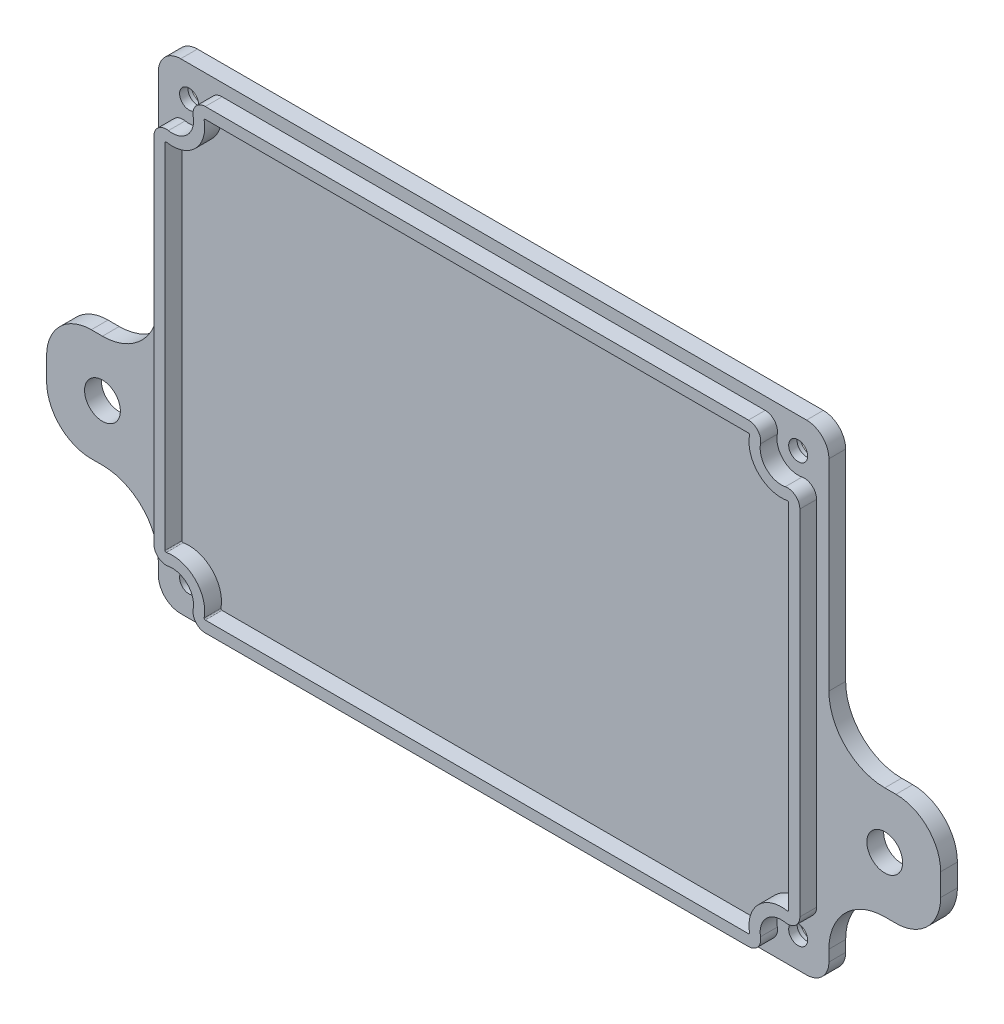
from build123d import *

# Parameters (mm, degrees)
SKETCH1_R           = 1.7
BOSS_EXTRUDE1_DEPTH = 3
BOSS_EXTRUDE2_DEPTH = 3
SKETCH3_R           = 3.2
BOSS_EXTRUDE3_DEPTH = 3
SKETCH4_R           = 2.85
SKETCH4_R_2         = 1.7
CUT_EXTRUDE1_DEPTH  = 1.5


with BuildPart() as part:
    # Sketch1 → Boss-Extrude1 (new body)
    with BuildSketch(Plane.XY):
        with BuildLine():
            Line((-56, -43), (56, -43))
            ThreePointArc((56, -43), (58.828427125, -41.828427125), (60, -39))
            Line((60, -39), (60, 39))
            ThreePointArc((60, 39), (58.828427125, 41.828427125), (56, 43))
            Line((56, 43), (-56, 43))
            ThreePointArc((-56, 43), (-58.828427125, 41.828427125), (-60, 39))
            Line((-60, 39), (-60, -39))
            ThreePointArc((-60, -39), (-58.828427125, -41.828427125), (-56, -43))
        make_face()
        with Locations((-54.5, 37.5)):
            Circle(SKETCH1_R, mode=Mode.SUBTRACT)
        with Locations(Location((-54.5, -37.5, 0), (0, 0, 180))):
            Circle(SKETCH1_R, mode=Mode.SUBTRACT)
        with Locations((54.5, -37.5)):
            Circle(SKETCH1_R, mode=Mode.SUBTRACT)
        with Locations(Location((54.5, 37.5, 0), (0, 0, 180))):
            Circle(SKETCH1_R, mode=Mode.SUBTRACT)
    extrude(amount=BOSS_EXTRUDE1_DEPTH)

    # Sketch2 → Boss-Extrude2 (add)
    with BuildSketch(Plane.XY.offset(3)):
        with BuildLine():
            Line((-57.8, 31.601695159), (-57.8, -31.601695159))
            ThreePointArc((-57.8, -31.601695159), (-57.005821231, -33.293932337), (-55.196666667, -33.764406934))
            ThreePointArc((-55.196666667, -33.764406934), (-51.812994231, -34.812994231), (-50.764406934, -38.196666667))
            ThreePointArc((-50.764406934, -38.196666667), (-50.293932337, -40.005821231), (-48.601695159, -40.8))
            Line((-48.601695159, -40.8), (48.601695159, -40.8))
            ThreePointArc((48.601695159, -40.8), (50.293932337, -40.005821231), (50.764406934, -38.196666667))
            ThreePointArc((50.764406934, -38.196666667), (51.812994231, -34.812994231), (55.196666667, -33.764406934))
            ThreePointArc((55.196666667, -33.764406934), (57.005821231, -33.293932337), (57.8, -31.601695159))
            Line((57.8, -31.601695159), (57.8, 31.601695159))
            ThreePointArc((57.8, 31.601695159), (57.005821231, 33.293932337), (55.196666667, 33.764406934))
            ThreePointArc((55.196666667, 33.764406934), (51.812994231, 34.812994231), (50.764406934, 38.196666667))
            ThreePointArc((50.764406934, 38.196666667), (50.293932337, 40.005821231), (48.601695159, 40.8))
            Line((48.601695159, 40.8), (-48.601695159, 40.8))
            ThreePointArc((-48.601695159, 40.8), (-50.293932337, 40.005821231), (-50.764406934, 38.196666667))
            ThreePointArc((-50.764406934, 38.196666667), (-51.812994231, 34.812994231), (-55.196666667, 33.764406934))
            ThreePointArc((-55.196666667, 33.764406934), (-57.005821231, 33.293932337), (-57.8, 31.601695159))
        make_face()
        with BuildLine():
            Line((-48.601695159, 38.8), (48.601695159, 38.8))
            ThreePointArc((48.601695159, 38.8), (48.755534902, 38.72780193), (48.79830532, 38.563333333))
            ThreePointArc((48.79830532, 38.563333333), (50.398780669, 33.398780669), (55.563333333, 31.79830532))
            ThreePointArc((55.563333333, 31.79830532), (55.72780193, 31.755534902), (55.8, 31.601695159))
            Line((55.8, 31.601695159), (55.8, -31.601695159))
            ThreePointArc((55.8, -31.601695159), (55.72780193, -31.755534902), (55.563333333, -31.79830532))
            ThreePointArc((55.563333333, -31.79830532), (50.398780669, -33.398780669), (48.79830532, -38.563333333))
            ThreePointArc((48.79830532, -38.563333333), (48.755534902, -38.72780193), (48.601695159, -38.8))
            Line((48.601695159, -38.8), (-48.601695159, -38.8))
            ThreePointArc((-48.601695159, -38.8), (-48.755534902, -38.72780193), (-48.79830532, -38.563333333))
            ThreePointArc((-48.79830532, -38.563333333), (-50.398780669, -33.398780669), (-55.563333333, -31.79830532))
            ThreePointArc((-55.563333333, -31.79830532), (-55.72780193, -31.755534902), (-55.8, -31.601695159))
            Line((-55.8, -31.601695159), (-55.8, 31.601695159))
            ThreePointArc((-55.8, 31.601695159), (-55.72780193, 31.755534902), (-55.563333333, 31.79830532))
            ThreePointArc((-55.563333333, 31.79830532), (-50.398780669, 33.398780669), (-48.79830532, 38.563333333))
            ThreePointArc((-48.79830532, 38.563333333), (-48.755534902, 38.72780193), (-48.601695159, 38.8))
        make_face(mode=Mode.SUBTRACT)
    extrude(amount=BOSS_EXTRUDE2_DEPTH)

    # Sketch3 → Boss-Extrude3 (add)
    # profile 1 of 2: a face of its own
    with BuildSketch(Plane.XY.offset(3)):
        with BuildLine():
            Line((60, 3), (60, -7))
            Line((60, -7), (60, -27))
            Line((60, -27), (60, -37))
            ThreePointArc((60, -37), (62.928932188, -29.928932188), (70, -27))
            Line((70, -27), (72, -27))
            ThreePointArc((72, -27), (77.656854249, -24.656854249), (80, -19))
            Line((80, -19), (80, -15))
            ThreePointArc((80, -15), (77.656854249, -9.343145751), (72, -7))
            Line((72, -7), (70, -7))
            ThreePointArc((70, -7), (62.928932188, -4.071067812), (60, 3))
        make_face()
        with Locations((70, -17)):
            Circle(SKETCH3_R, mode=Mode.SUBTRACT)
    # profile 2 of 2: a face of its own
    with BuildSketch(Plane.XY.offset(3)):
        with BuildLine():
            Line((-70, -7), (-72, -7))
            ThreePointArc((-72, -7), (-77.656854249, -9.343145751), (-80, -15))
            Line((-80, -15), (-80, -19))
            ThreePointArc((-80, -19), (-77.656854249, -24.656854249), (-72, -27))
            Line((-72, -27), (-70, -27))
            ThreePointArc((-70, -27), (-62.928932188, -29.928932188), (-60, -37))
            Line((-60, -37), (-60, -27))
            Line((-60, -27), (-60, -7))
            Line((-60, -7), (-60, 3))
            ThreePointArc((-60, 3), (-62.928932188, -4.071067812), (-70, -7))
        make_face()
        with Locations(Location((-70, -17, 0), (0, 0, 180))):
            Circle(SKETCH3_R, mode=Mode.SUBTRACT)
    extrude(amount=-BOSS_EXTRUDE3_DEPTH)

    # Sketch4 → Cut-Extrude1 (cut)
    # profile 1 of 4: a face of its own
    with BuildSketch(Plane(origin=(0, 0, 0), x_dir=(-1, 0, 0), z_dir=(0, 0, -1))):
        with Locations((-54.5, 37.5)):
            Circle(SKETCH4_R)
        with Locations((-54.5, 37.5)):
            Circle(SKETCH4_R_2, mode=Mode.SUBTRACT)
    # profile 2 of 4: a face of its own
    with BuildSketch(Plane(origin=(0, 0, 0), x_dir=(-1, 0, 0), z_dir=(0, 0, -1))):
        with Locations((54.5, 37.5)):
            Circle(SKETCH4_R)
        with Locations((54.5, 37.5)):
            Circle(SKETCH4_R_2, mode=Mode.SUBTRACT)
    # profile 3 of 4: a face of its own
    with BuildSketch(Plane(origin=(0, 0, 0), x_dir=(-1, 0, 0), z_dir=(0, 0, -1))):
        with Locations((54.5, -37.5)):
            Circle(SKETCH4_R)
        with Locations((54.5, -37.5)):
            Circle(SKETCH4_R_2, mode=Mode.SUBTRACT)
    # profile 4 of 4: a face of its own
    with BuildSketch(Plane(origin=(0, 0, 0), x_dir=(-1, 0, 0), z_dir=(0, 0, -1))):
        with Locations((-54.5, -37.5)):
            Circle(SKETCH4_R)
        with Locations((-54.5, -37.5)):
            Circle(SKETCH4_R_2, mode=Mode.SUBTRACT)
    extrude(amount=-CUT_EXTRUDE1_DEPTH, mode=Mode.SUBTRACT)


solid = part.part
